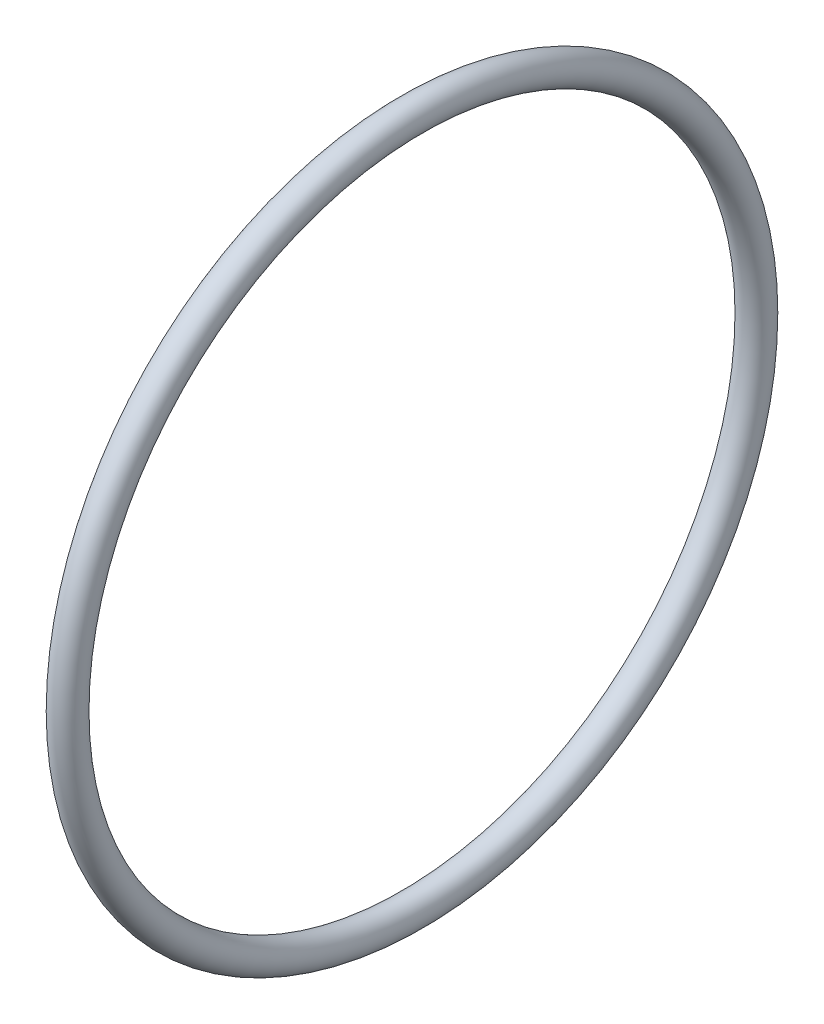
from build123d import *

# Parameters (mm, degrees)
ESQUISSE1_R = 2


with BuildPart() as part:
    # Esquisse1 → Base-Révolution (revolve)
    with BuildSketch(Plane.XY, mode=Mode.PRIVATE) as base_r_volution_sk:
        with Locations((2, 45.5)):
            Circle(ESQUISSE1_R)
    revolve(base_r_volution_sk.sketch.rotate(Axis((0, 0, 0), (1, 0, 0)), 90), axis=Axis((0, 0, 0), (1, 0, 0)))


solid = part.part
